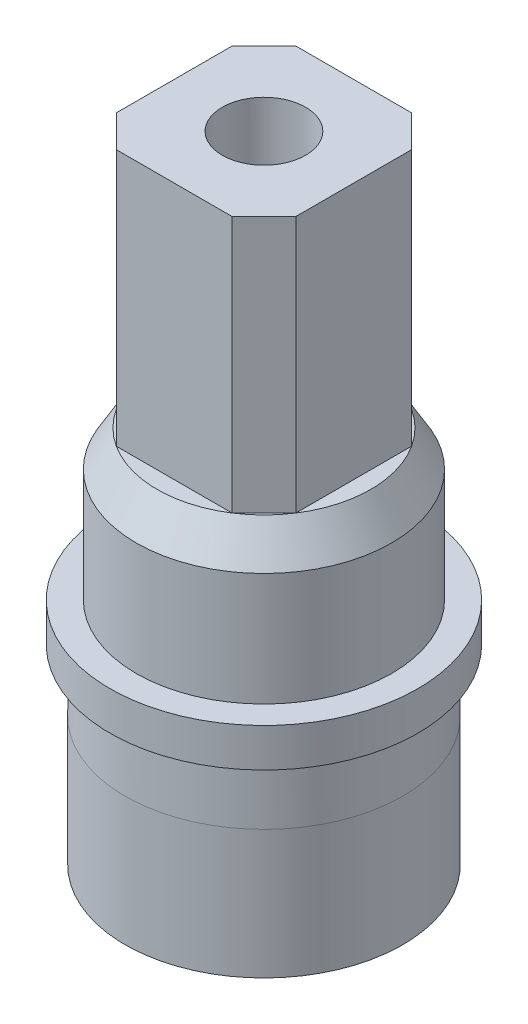
from build123d import *
from build123d.topology import SkipClean

# Parameters (mm, degrees)
BOSS_EXTRUDE1_START      = 7.7
SKETCH2_R                = 1.295
BOSS_EXTRUDE1_DEPTH      = 7.7
SKETCH3_R                = 2.7
BOSS_EXTRUDE4_DEPTH      = 6
SKETCH5_R                = 4.484484463
CUT_EXTRUDE1_DEPTH       = 1
SKETCH8_R                = 4.315
BOSS_EXTRUDE8_DEPTH      = 8
CUT_EXTRUDE4_DEPTH       = 10.2
CUT_EXTRUDE11_DEPTH      = 19.337852928
CUT_EXTRUDE11_DEPTH_BACK = 19.337852928
SKETCH14_W               = 2.622578867
SKETCH14_H               = 4.71707074
BOSS_EXTRUDE9_START      = 5
SKETCH16_R               = 1.295
BOSS_EXTRUDE9_DEPTH      = 5
CUT_EXTRUDE12_DEPTH      = 14
SKETCH22_R               = 4.315
CUT_EXTRUDE14_DEPTH      = 4


with BuildPart() as part:
    # Sketch1 → Revolve1 (revolve)
    with BuildSketch(Plane.XY, mode=Mode.PRIVATE) as revolve1_sk:
        Polygon((-2.7, 0), (-2.7, 5.54), (-1.295, 5.54), (-1.295, 8.3), (-3.32, 8.3), (-3.97, 7.184383121), (-3.97, 3.67), (-4.785, 3.67), (-4.785, 2.47), (-4.28, 2.47), (-4.325, 0), align=None)
    revolve(revolve1_sk.sketch.rotate(Axis((0, 0, 0), (0, 1, 0)), 270), axis=Axis((0, 0, 0), (0, 1, 0)))

    # Sketch2 → Boss-Extrude1 (add)
    with BuildSketch(Plane(origin=(0, 8.3, 0), x_dir=(1, 0, 0), z_dir=(0, 1, 0)).offset(BOSS_EXTRUDE1_START)):
        Polygon((1.799527716, 2.79), (-1.799527716, 2.79), (-2.79, 1.799527716), (-2.79, -1.799527716), (-1.799527716, -2.79), (1.799527716, -2.79), (2.79, -1.799527716), (2.79, 1.799527716), align=None)
        with Locations(Location((0, 0, 0), (0, 0, 90))):
            Circle(SKETCH2_R, mode=Mode.SUBTRACT)
    extrude(amount=-BOSS_EXTRUDE1_DEPTH)

    # Sketch3 → Boss-Extrude4 (add)
    with BuildSketch(Plane.XZ.offset(-5.54)):
        with Locations(Location((0, 0, 0), (0, 0, 270))):
            Circle(SKETCH3_R)
    extrude(amount=BOSS_EXTRUDE4_DEPTH)

    # Sketch5 → Cut-Extrude1 (cut)
    with BuildSketch(Plane.XZ.offset(0.46)):
        Circle(SKETCH5_R)
    extrude(amount=-CUT_EXTRUDE1_DEPTH, mode=Mode.SUBTRACT)


with BuildPart() as body_2:
    # Sketch8 → Boss-Extrude8 (new body)
    with BuildSketch(Plane.XZ.offset(-0.54)):
        with Locations(Location((0, 0, 0), (0, 0, 270))):
            Circle(SKETCH8_R)
    extrude(amount=BOSS_EXTRUDE8_DEPTH)


with BuildPart() as cut_extrude4_tool:
    # Sketch13 → Cut-Extrude4 (new body)
    with BuildSketch(Plane.XZ.offset(7.46)):
        with BuildLine():
            ThreePointArc((1.6, 0), (-0.71250829, 1.432596222), (-0.96541492, -1.275920857))
            Line((-0.96541492, -1.275920857), (1.145236615, -1.117333029))
            ThreePointArc((1.145236615, -1.117333029), (1.481954551, -0.603167231), (1.6, 0))
        make_face()
    extrude(amount=-CUT_EXTRUDE4_DEPTH)


with BuildPart() as part_1:
    add(part.part)

    # Cut-Extrude4: cut by cut_extrude4_tool
    add(cut_extrude4_tool.part, mode=Mode.SUBTRACT)

    # Sketch14 → Cut-Extrude11 (cut, two sides: drawn at the far end of the back side and taken through both)
    with BuildSketch(Plane.ZY.offset(2.79).offset(-CUT_EXTRUDE11_DEPTH_BACK)):
        Polygon((-1.799527716, 11.28292926), (1.799527716, 11.28292926), (1.799527716, 16), (-1.799527716, 16), (-1.799527716, 11.405412722), align=None)
        with Locations((3.11081715, 13.64146463)):
            Rectangle(SKETCH14_W, SKETCH14_H)
        Polygon((-3.994671482, 11.28292926), (-1.799527716, 11.28292926), (-1.799527716, 11.405412722), (-1.799527716, 16), (-3.994671482, 16), align=None)
    extrude(amount=CUT_EXTRUDE11_DEPTH + CUT_EXTRUDE11_DEPTH_BACK, mode=Mode.SUBTRACT)

    # Sketch16 → Boss-Extrude9 (add)
    with BuildSketch(Plane(origin=(0, 11.28292926, 0), x_dir=(1, 0, 0), z_dir=(0, 1, 0)).offset(BOSS_EXTRUDE9_START)):
        Polygon((-2.79, -1.799527716), (-2.79, 1.799527716), (-1.799527716, 2.79), (1.799527716, 2.79), (2.79, 1.799527716), (2.79, -1.799527716), (1.799527716, -2.79), (-1.799527716, -2.79), align=None)
        with Locations(Location((0, 0, 0), (0, 0, 90))):
            Circle(SKETCH16_R, mode=Mode.SUBTRACT)
    extrude(amount=-BOSS_EXTRUDE9_DEPTH)

    # Sketch21 → Cut-Extrude12 (cut)
    with SkipClean():  # the faces are left unmerged after this step: merging them gives an invalid solid
        with BuildSketch(Plane.XZ.offset(7.46)):
            with BuildLine():
                Line((1.145236615, -1.117333029), (-0.96541492, -1.275920857))
                ThreePointArc((-0.96541492, -1.275920857), (-0.11988113, 1.59550259), (1.145236615, -1.117333029))
            make_face()
        extrude(amount=-CUT_EXTRUDE12_DEPTH, mode=Mode.SUBTRACT)


with BuildPart() as body_2_1:
    add(body_2.part)

    # Cut-Extrude4: cut by cut_extrude4_tool
    add(cut_extrude4_tool.part, mode=Mode.SUBTRACT)

    # Sketch22 → Cut-Extrude14 (cut)
    # profile 1 of 3: a face of its own
    with BuildSketch(Plane.XZ.offset(7.46)):
        with Locations(Location((0, 0, 0), (0, 0, 270))):
            Circle(SKETCH22_R)
        with BuildLine():
            ThreePointArc((1.6, 0), (1.481954551, -0.603167231), (1.145236615, -1.117333029))
            ThreePointArc((1.145236615, -1.117333029), (0.11988113, -1.59550259), (-0.96541492, -1.275920857))
            ThreePointArc((-0.96541492, -1.275920857), (-0.71250829, 1.432596222), (1.6, 0))
        make_face(mode=Mode.SUBTRACT)
    # profile 2 of 3: a face of its own
    with BuildSketch(Plane.XZ.offset(7.46)):
        with BuildLine():
            ThreePointArc((-0.96541492, -1.275920857), (0.11988113, -1.59550259), (1.145236615, -1.117333029))
            Line((1.145236615, -1.117333029), (-0.96541492, -1.275920857))
        make_face()
    # profile 3 of 3: a face of its own
    with BuildSketch(Plane.XZ.offset(7.46)):
        with BuildLine():
            Line((-0.96541492, -1.275920857), (1.145236615, -1.117333029))
            ThreePointArc((1.145236615, -1.117333029), (1.481954551, -0.603167231), (1.6, 0))
            ThreePointArc((1.6, 0), (-0.71250829, 1.432596222), (-0.96541492, -1.275920857))
        make_face()
    extrude(amount=-CUT_EXTRUDE14_DEPTH, mode=Mode.SUBTRACT)


solid = Compound([part_1.part, body_2_1.part])
